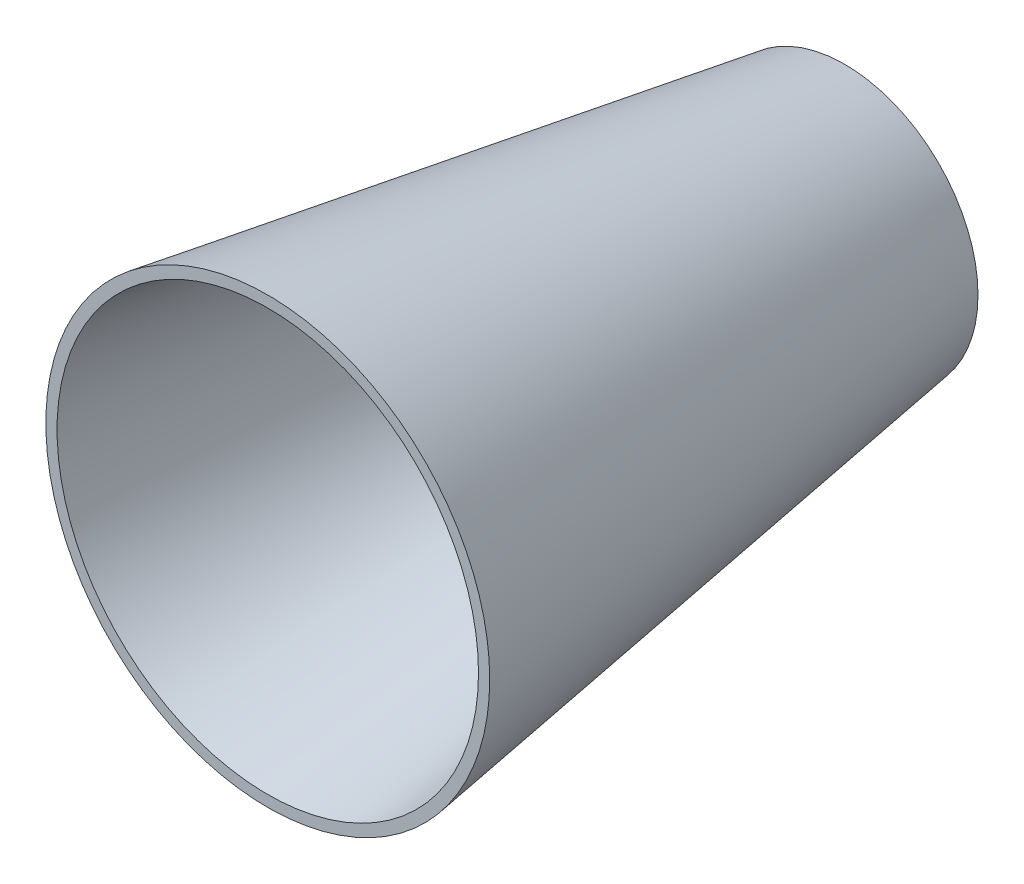
from build123d import *

# Parameters (mm, degrees)
ESQUISSE1_R = 30
ESQUISSE2_R = 50
COQUE1_T    = -2.5


with BuildPart() as part:
    # Esquisse1 → Lissage1 section 0
    with BuildSketch(Plane.XY):
        Circle(ESQUISSE1_R)
    # Esquisse2 → Lissage1 section 1
    with BuildSketch(Plane.XY.offset(130)):
        Circle(ESQUISSE2_R)
    loft()

    # Coque1
    coque1_openings = [part.faces().sort_by_distance(p)[0] for p in [
        (0, 0, 130),
    ]]
    offset(amount=COQUE1_T, openings=coque1_openings, kind=Kind.INTERSECTION)


solid = part.part
